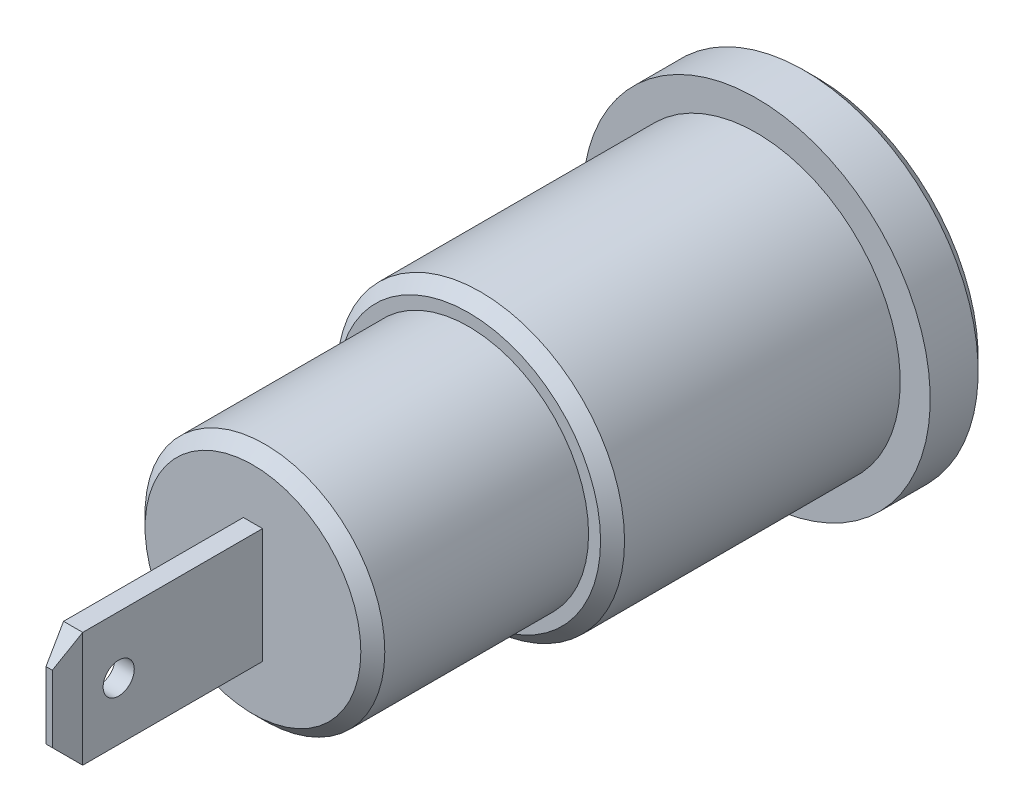
from build123d import *

# Parameters (mm, degrees)
ESQUISSE1_R             = 6
BOSS_EXTRU_1_DEPTH      = 12
ESQUISSE2_R             = 5
BOSS_EXTRU_2_DEPTH      = 9
ESQUISSE3_R             = 7.25
BOSS_EXTRU_3_DEPTH      = 2.5
ESQUISSE4_R             = 2
ENL_V_MAT_EXTRU_1_DEPTH = 20
ESQUISSE9_R             = 2.1
ENL_V_MAT_EXTRU_4_DEPTH = 5.5
ESQUISSE6_R             = 4.25
ESQUISSE6_R_2           = 2.5
ENL_V_MAT_EXTRU_2_DEPTH = 10
CHANFREIN1_SIZE         = 0.5
CHANFREIN2_SIZE         = 0.2
BOSS_EXTRU_4_DEPTH      = 0.4
BOSS_EXTRU_4_DEPTH_BACK = 0.4
ESQUISSE8_R             = 0.65
CHANFREIN3_SIZE         = 1
CHANFREIN3_SIZE2        = 0.267949192
CHANFREIN4_SIZE         = 1
CHANFREIN4_SIZE2        = 0.267949192


with BuildPart() as part:
    # Esquisse1 → Boss.-Extru.1 (new body)
    with BuildSketch(Plane.XY):
        Circle(ESQUISSE1_R)
    extrude(amount=BOSS_EXTRU_1_DEPTH)

    # Esquisse2 → Boss.-Extru.2 (add)
    with BuildSketch(Plane.XY.offset(12)):
        Circle(ESQUISSE2_R)
    extrude(amount=BOSS_EXTRU_2_DEPTH)

    # Esquisse3 → Boss.-Extru.3 (add)
    with BuildSketch(Plane(origin=(0, 0, 0), x_dir=(-1, 0, 0), z_dir=(0, 0, -1))):
        Circle(ESQUISSE3_R)
    extrude(amount=BOSS_EXTRU_3_DEPTH)

    # Esquisse4 → Enlèv. mat.-Extru.1 (cut)
    with BuildSketch(Plane(origin=(0, 0, -2.5), x_dir=(-1, 0, 0), z_dir=(0, 0, -1))):
        Circle(ESQUISSE4_R)
    extrude(amount=-ENL_V_MAT_EXTRU_1_DEPTH, mode=Mode.SUBTRACT)

    # Esquisse9 → Enlèv. mat.-Extru.4 (cut)
    with BuildSketch(Plane(origin=(0, 0, -2.5), x_dir=(-1, 0, 0), z_dir=(0, 0, -1))):
        Circle(ESQUISSE9_R)
    extrude(amount=-ENL_V_MAT_EXTRU_4_DEPTH, mode=Mode.SUBTRACT)

    # Esquisse6 → Enlèv. mat.-Extru.2 (cut)
    with BuildSketch(Plane(origin=(0, 0, -2.5), x_dir=(-1, 0, 0), z_dir=(0, 0, -1))):
        Circle(ESQUISSE6_R)
        Circle(ESQUISSE6_R_2, mode=Mode.SUBTRACT)
    extrude(amount=-ENL_V_MAT_EXTRU_2_DEPTH, mode=Mode.SUBTRACT)

    # Chanfrein1
    chanfrein1_edges = [part.edges().sort_by_distance(p)[0] for p in [
        (7.25, 0, -2.5),
        (-6, 0, 12),
        (4.25, 0, -2.5),
        (-5, 0, 21),
    ]]
    chamfer(chanfrein1_edges, length=CHANFREIN1_SIZE)

    # Chanfrein2
    chanfrein2_edges = [part.edges().sort_by_distance(p)[0] for p in [
        (2.5, 0, -2.5),
    ]]
    chamfer(chanfrein2_edges, length=CHANFREIN2_SIZE)

    # Esquisse8 → Boss.-Extru.4 (add, two sides: drawn at the far end of the back side and taken through both)
    with BuildSketch(Plane(origin=(0, 0, 0), x_dir=(0, 0, -1), z_dir=(1, 0, 0)).offset(-BOSS_EXTRU_4_DEPTH_BACK)):
        Polygon((-21, -2.4), (-28.5, -2.4), (-29.5, -1.4), (-29.5, 1.4), (-28.5, 2.4), (-21, 2.4), align=None)
        with Locations((-27, 0)):
            Circle(ESQUISSE8_R, mode=Mode.SUBTRACT)
    extrude(amount=BOSS_EXTRU_4_DEPTH + BOSS_EXTRU_4_DEPTH_BACK)

    # Chanfrein3
    chanfrein3_edges = [part.edges().sort_by_distance(p)[0] for p in [
        (0.4, 0, 29.5),
    ]]
    chanfrein3_side = [part.faces().sort_by_distance(p)[0] for p in [
        (0.4, 0, 25.087820443),
    ]]
    chamfer(chanfrein3_edges, length=CHANFREIN3_SIZE, length2=CHANFREIN3_SIZE2, reference=chanfrein3_side[0])

    # Chanfrein4
    chanfrein4_edges = [part.edges().sort_by_distance(p)[0] for p in [
        (-0.4, 0, 29.5),
    ]]
    chanfrein4_side = [part.faces().sort_by_distance(p)[0] for p in [
        (-0.4, 0, 25.087820443),
    ]]
    chamfer(chanfrein4_edges, length=CHANFREIN4_SIZE, length2=CHANFREIN4_SIZE2, reference=chanfrein4_side[0])


solid = part.part
